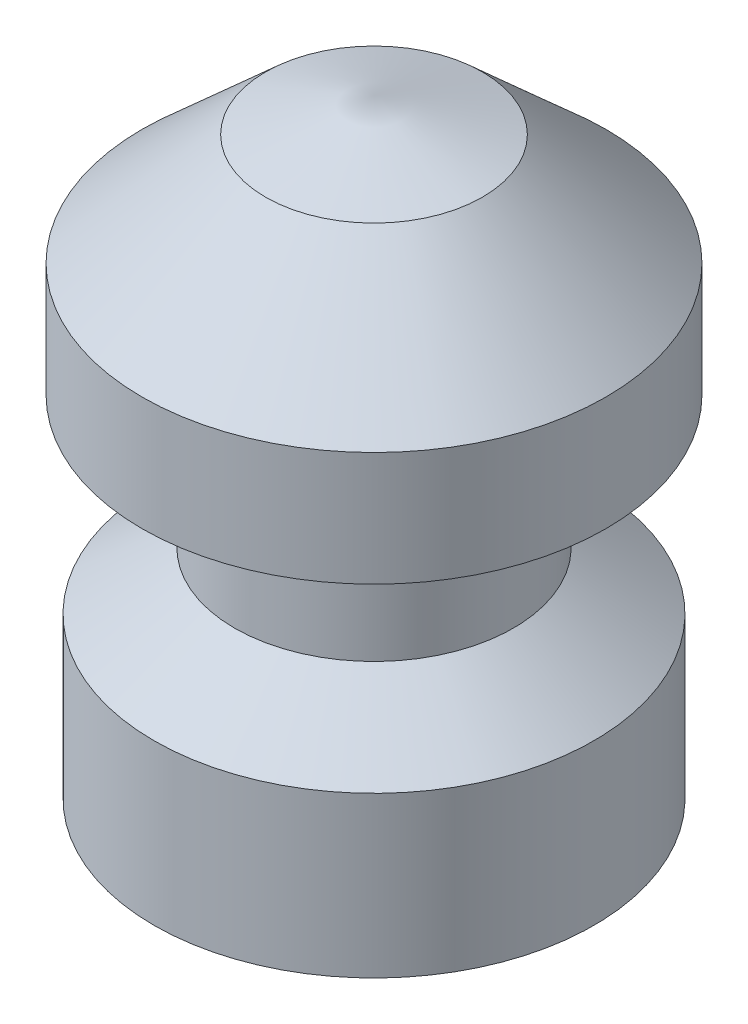
from build123d import *


with BuildPart() as part:
    # 스케치1 → 회전1 (revolve)
    with BuildSketch(Plane(origin=(0, 0, 0), x_dir=(0, 0, -1), z_dir=(1, 0, 0)), mode=Mode.PRIVATE) as revolve_1_sk:
        Polygon((0, 0), (0.495725515, 0), (1.75, -1.612980168), (2.75, -1.612980168), (2.75, 0.387019832), (1.743371525, 1.102989251), (1.743371525, 2.102989251), (2.9, 2.757946751), (2.9, 4.183903925), (1.356376494, 5.576732475), (0, 6), align=None)
    revolve(revolve_1_sk.sketch.rotate(Axis((0, 6, 0), (0, -1, 0)), 180), axis=Axis((0, 6, 0), (0, -1, 0)))


solid = part.part
